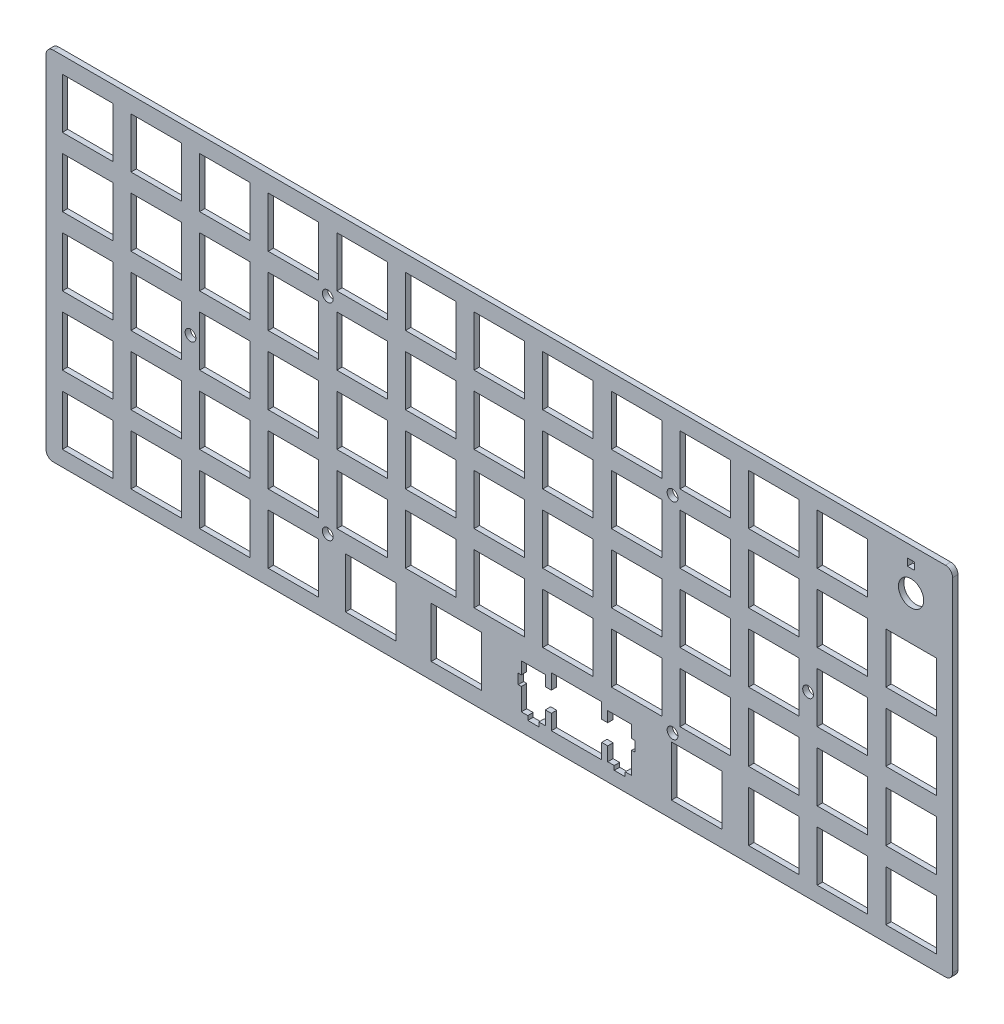
from build123d import *

# Parameters (mm, degrees)
SKETCH4_R           = 3.5
SKETCH4_R_2         = 1.5
SKETCH4_W           = 13.9954
SKETCH4_H           = 13.9954
SKETCH4_W_2         = 2
SKETCH4_H_2         = 2
BOSS_EXTRUDE2_DEPTH = 1.5


with BuildPart() as part:
    # Sketch4 → Boss-Extrude2 (new body)
    with BuildSketch(Plane.XY):
        with BuildLine():
            Line((-123.825, 49.505646916), (123.825, 49.505646916))
            ThreePointArc((123.825, 49.505646916), (125.239213562, 48.919860478), (125.825, 47.505646916))
            Line((125.825, 47.505646916), (125.825, -47.505646916))
            ThreePointArc((125.825, -47.505646916), (125.239213562, -48.919860478), (123.825, -49.505646916))
            Line((123.825, -49.505646916), (-123.825, -49.505646916))
            ThreePointArc((-123.825, -49.505646916), (-125.239213562, -48.919860478), (-125.825, -47.505646916))
            Line((-125.825, -47.505646916), (-125.825, 47.505646916))
            ThreePointArc((-125.825, 47.505646916), (-125.239213562, 48.919860478), (-123.825, 49.505646916))
        make_face()
        with Locations((114.3, 37.980646916)):
            Circle(SKETCH4_R, mode=Mode.SUBTRACT)
        with Locations((-85.725, 0)):
            Circle(SKETCH4_R_2, mode=Mode.SUBTRACT)
        with Locations((85.725, 0)):
            Circle(SKETCH4_R_2, mode=Mode.SUBTRACT)
        with Locations((48.090844665, -28.694353084)):
            Circle(SKETCH4_R_2, mode=Mode.SUBTRACT)
        with Locations((48.090844665, 28.455646916)):
            Circle(SKETCH4_R_2, mode=Mode.SUBTRACT)
        with Locations((-47.625, 28.455646916)):
            Circle(SKETCH4_R_2, mode=Mode.SUBTRACT)
        with Locations((-47.625, -28.694353084)):
            Circle(SKETCH4_R_2, mode=Mode.SUBTRACT)
        with Locations((-114.3, 37.980646916)):
            Rectangle(SKETCH4_W, SKETCH4_H, mode=Mode.SUBTRACT)
        with Locations((-95.25, 37.980646916)):
            Rectangle(SKETCH4_W, SKETCH4_H, mode=Mode.SUBTRACT)
        with Locations((-76.2, 37.980646916)):
            Rectangle(SKETCH4_W, SKETCH4_H, mode=Mode.SUBTRACT)
        with Locations((-57.15, 37.980646916)):
            Rectangle(SKETCH4_W, SKETCH4_H, mode=Mode.SUBTRACT)
        with Locations((-38.1, 37.980646916)):
            Rectangle(SKETCH4_W, SKETCH4_H, mode=Mode.SUBTRACT)
        with Locations((-19.05, 37.980646916)):
            Rectangle(SKETCH4_W, SKETCH4_H, mode=Mode.SUBTRACT)
        with Locations((0, 37.980646916)):
            Rectangle(SKETCH4_W, SKETCH4_H, mode=Mode.SUBTRACT)
        with Locations((19.05, 37.980646916)):
            Rectangle(SKETCH4_W, SKETCH4_H, mode=Mode.SUBTRACT)
        with Locations((38.1, 37.980646916)):
            Rectangle(SKETCH4_W, SKETCH4_H, mode=Mode.SUBTRACT)
        with Locations((57.15, 37.980646916)):
            Rectangle(SKETCH4_W, SKETCH4_H, mode=Mode.SUBTRACT)
        with Locations((76.2, 37.980646916)):
            Rectangle(SKETCH4_W, SKETCH4_H, mode=Mode.SUBTRACT)
        with Locations((95.25, 37.980646916)):
            Rectangle(SKETCH4_W, SKETCH4_H, mode=Mode.SUBTRACT)
        with Locations((-95.25, 18.930646916)):
            Rectangle(SKETCH4_W, SKETCH4_H, mode=Mode.SUBTRACT)
        with Locations((-76.2, 18.930646916)):
            Rectangle(SKETCH4_W, SKETCH4_H, mode=Mode.SUBTRACT)
        with Locations((-57.15, 18.930646916)):
            Rectangle(SKETCH4_W, SKETCH4_H, mode=Mode.SUBTRACT)
        with Locations((-38.1, 18.930646916)):
            Rectangle(SKETCH4_W, SKETCH4_H, mode=Mode.SUBTRACT)
        with Locations((-19.05, 18.930646916)):
            Rectangle(SKETCH4_W, SKETCH4_H, mode=Mode.SUBTRACT)
        with Locations((0, 18.930646916)):
            Rectangle(SKETCH4_W, SKETCH4_H, mode=Mode.SUBTRACT)
        with Locations((19.05, 18.930646916)):
            Rectangle(SKETCH4_W, SKETCH4_H, mode=Mode.SUBTRACT)
        with Locations((38.1, 18.930646916)):
            Rectangle(SKETCH4_W, SKETCH4_H, mode=Mode.SUBTRACT)
        with Locations((57.15, 18.930646916)):
            Rectangle(SKETCH4_W, SKETCH4_H, mode=Mode.SUBTRACT)
        with Locations((76.2, 18.930646916)):
            Rectangle(SKETCH4_W, SKETCH4_H, mode=Mode.SUBTRACT)
        with Locations((95.25, 18.930646916)):
            Rectangle(SKETCH4_W, SKETCH4_H, mode=Mode.SUBTRACT)
        with Locations((114.3, 18.930646916)):
            Rectangle(SKETCH4_W, SKETCH4_H, mode=Mode.SUBTRACT)
        with Locations((-95.25, -0.119353084)):
            Rectangle(SKETCH4_W, SKETCH4_H, mode=Mode.SUBTRACT)
        with Locations((-76.2, -0.119353084)):
            Rectangle(SKETCH4_W, SKETCH4_H, mode=Mode.SUBTRACT)
        with Locations((-57.15, -0.119353084)):
            Rectangle(SKETCH4_W, SKETCH4_H, mode=Mode.SUBTRACT)
        with Locations((-38.1, -0.119353084)):
            Rectangle(SKETCH4_W, SKETCH4_H, mode=Mode.SUBTRACT)
        with Locations((-19.05, -0.119353084)):
            Rectangle(SKETCH4_W, SKETCH4_H, mode=Mode.SUBTRACT)
        with Locations((0, -0.119353084)):
            Rectangle(SKETCH4_W, SKETCH4_H, mode=Mode.SUBTRACT)
        with Locations((19.05, -0.119353084)):
            Rectangle(SKETCH4_W, SKETCH4_H, mode=Mode.SUBTRACT)
        with Locations((38.1, -0.119353084)):
            Rectangle(SKETCH4_W, SKETCH4_H, mode=Mode.SUBTRACT)
        with Locations((57.15, -0.119353084)):
            Rectangle(SKETCH4_W, SKETCH4_H, mode=Mode.SUBTRACT)
        with Locations((76.2, -0.119353084)):
            Rectangle(SKETCH4_W, SKETCH4_H, mode=Mode.SUBTRACT)
        with Locations((95.25, -0.119353084)):
            Rectangle(SKETCH4_W, SKETCH4_H, mode=Mode.SUBTRACT)
        with Locations((114.3, -0.119353084)):
            Rectangle(SKETCH4_W, SKETCH4_H, mode=Mode.SUBTRACT)
        with Locations((-95.25, -19.169353084)):
            Rectangle(SKETCH4_W, SKETCH4_H, mode=Mode.SUBTRACT)
        with Locations((-76.2, -19.169353084)):
            Rectangle(SKETCH4_W, SKETCH4_H, mode=Mode.SUBTRACT)
        with Locations((-57.15, -19.169353084)):
            Rectangle(SKETCH4_W, SKETCH4_H, mode=Mode.SUBTRACT)
        with Locations((-38.1, -19.169353084)):
            Rectangle(SKETCH4_W, SKETCH4_H, mode=Mode.SUBTRACT)
        with Locations((-19.05, -19.169353084)):
            Rectangle(SKETCH4_W, SKETCH4_H, mode=Mode.SUBTRACT)
        with Locations((0, -19.169353084)):
            Rectangle(SKETCH4_W, SKETCH4_H, mode=Mode.SUBTRACT)
        with Locations((19.05, -19.169353084)):
            Rectangle(SKETCH4_W, SKETCH4_H, mode=Mode.SUBTRACT)
        with Locations((38.1, -19.169353084)):
            Rectangle(SKETCH4_W, SKETCH4_H, mode=Mode.SUBTRACT)
        with Locations((57.15, -19.169353084)):
            Rectangle(SKETCH4_W, SKETCH4_H, mode=Mode.SUBTRACT)
        with Locations((76.2, -19.169353084)):
            Rectangle(SKETCH4_W, SKETCH4_H, mode=Mode.SUBTRACT)
        with Locations((95.25, -19.169353084)):
            Rectangle(SKETCH4_W, SKETCH4_H, mode=Mode.SUBTRACT)
        with Locations((114.3, -19.169353084)):
            Rectangle(SKETCH4_W, SKETCH4_H, mode=Mode.SUBTRACT)
        with Locations((-95.25, -38.219353084)):
            Rectangle(SKETCH4_W, SKETCH4_H, mode=Mode.SUBTRACT)
        with Locations((-76.2, -38.219353084)):
            Rectangle(SKETCH4_W, SKETCH4_H, mode=Mode.SUBTRACT)
        with Locations((-57.15, -38.219353084)):
            Rectangle(SKETCH4_W, SKETCH4_H, mode=Mode.SUBTRACT)
        with Locations((76.2, -38.219353084)):
            Rectangle(SKETCH4_W, SKETCH4_H, mode=Mode.SUBTRACT)
        with Locations((95.25, -38.219353084)):
            Rectangle(SKETCH4_W, SKETCH4_H, mode=Mode.SUBTRACT)
        with Locations((114.3, -38.219353084)):
            Rectangle(SKETCH4_W, SKETCH4_H, mode=Mode.SUBTRACT)
        with Locations((-114.3, 18.930646916)):
            Rectangle(SKETCH4_W, SKETCH4_H, mode=Mode.SUBTRACT)
        with Locations((-114.3, -0.119353084)):
            Rectangle(SKETCH4_W, SKETCH4_H, mode=Mode.SUBTRACT)
        with Locations((-114.3, -19.169353084)):
            Rectangle(SKETCH4_W, SKETCH4_H, mode=Mode.SUBTRACT)
        with Locations((-114.3, -38.219353084)):
            Rectangle(SKETCH4_W, SKETCH4_H, mode=Mode.SUBTRACT)
        with Locations((-35.71875, -38.010485187)):
            Rectangle(SKETCH4_W, SKETCH4_H, mode=Mode.SUBTRACT)
        with Locations((-11.90625, -38.010485187)):
            Rectangle(SKETCH4_W, SKETCH4_H, mode=Mode.SUBTRACT)
        with Locations((54.76875, -38.010485187)):
            Rectangle(SKETCH4_W, SKETCH4_H, mode=Mode.SUBTRACT)
        with Locations((114.3, 44.978346916)):
            Rectangle(SKETCH4_W_2, SKETCH4_H_2, mode=Mode.SUBTRACT)
        Polygon((14.44625, -31.025485187), (28.41625, -31.025485187), (28.41625, -35.24359867), (30.10385, -35.24359867), (30.10385, -32.320885187), (36.75865, -32.320885187), (36.75865, -35.724485187), (37.62225, -35.724485187), (37.62225, -38.518485187), (36.75865, -38.518485187), (36.75865, -44.614485187), (34.95525, -44.614485187), (34.95525, -45.782885187), (31.90725, -45.782885187), (31.90725, -44.614485187), (30.10385, -44.614485187), (30.10385, -40.803905948), (28.41625, -40.803905948), (28.41625, -44.995485187), (14.44625, -44.995485187), (14.44625, -40.803905948), (12.75865, -40.803905948), (12.75865, -44.614485187), (10.95525, -44.614485187), (10.95525, -45.782885187), (7.90725, -45.782885187), (7.90725, -44.614485187), (6.10385, -44.614485187), (6.10385, -38.518485187), (5.24025, -38.518485187), (5.24025, -35.724485187), (6.10385, -35.724485187), (6.10385, -32.320885187), (12.75865, -32.320885187), (12.75865, -35.24359867), (14.44625, -35.24359867), align=None, mode=Mode.SUBTRACT)
    extrude(amount=BOSS_EXTRUDE2_DEPTH)


solid = part.part
